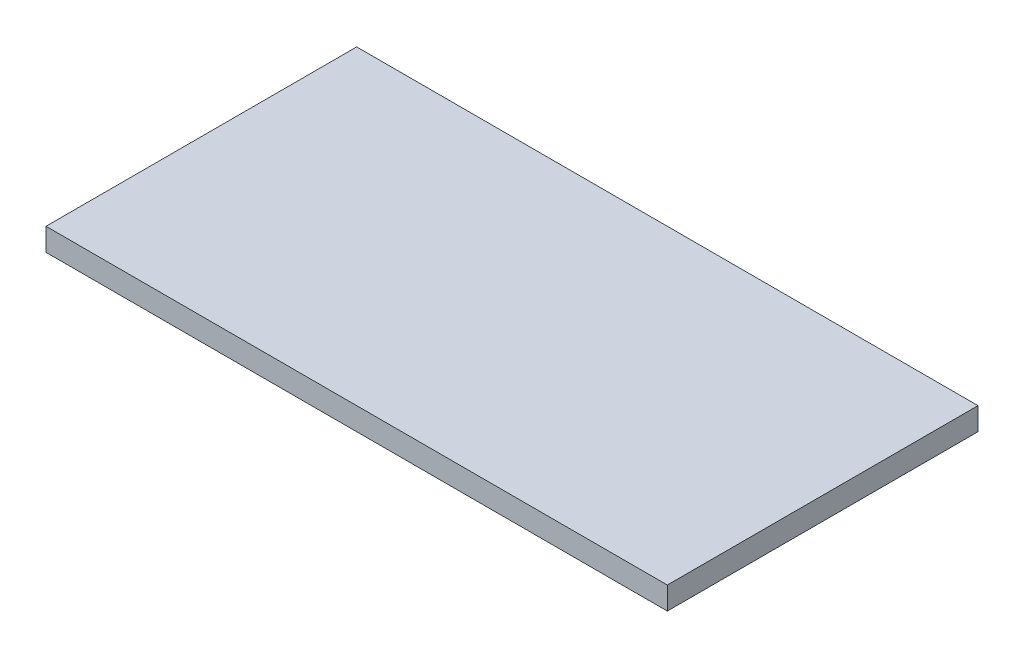
from build123d import *

# Parameters (mm, degrees)
CROQUIS1_W              = 110
CROQUIS1_H              = 55
SALIENTE_EXTRUIR1_DEPTH = 2


with BuildPart() as part:
    # Croquis1 → Saliente-Extruir1 (new, symmetric)
    with BuildSketch(Plane(origin=(0, 0, 0), x_dir=(1, 0, 0), z_dir=(0, 1, 0))):
        Rectangle(CROQUIS1_W, CROQUIS1_H)
    extrude(amount=SALIENTE_EXTRUIR1_DEPTH, both=True)


solid = part.part
